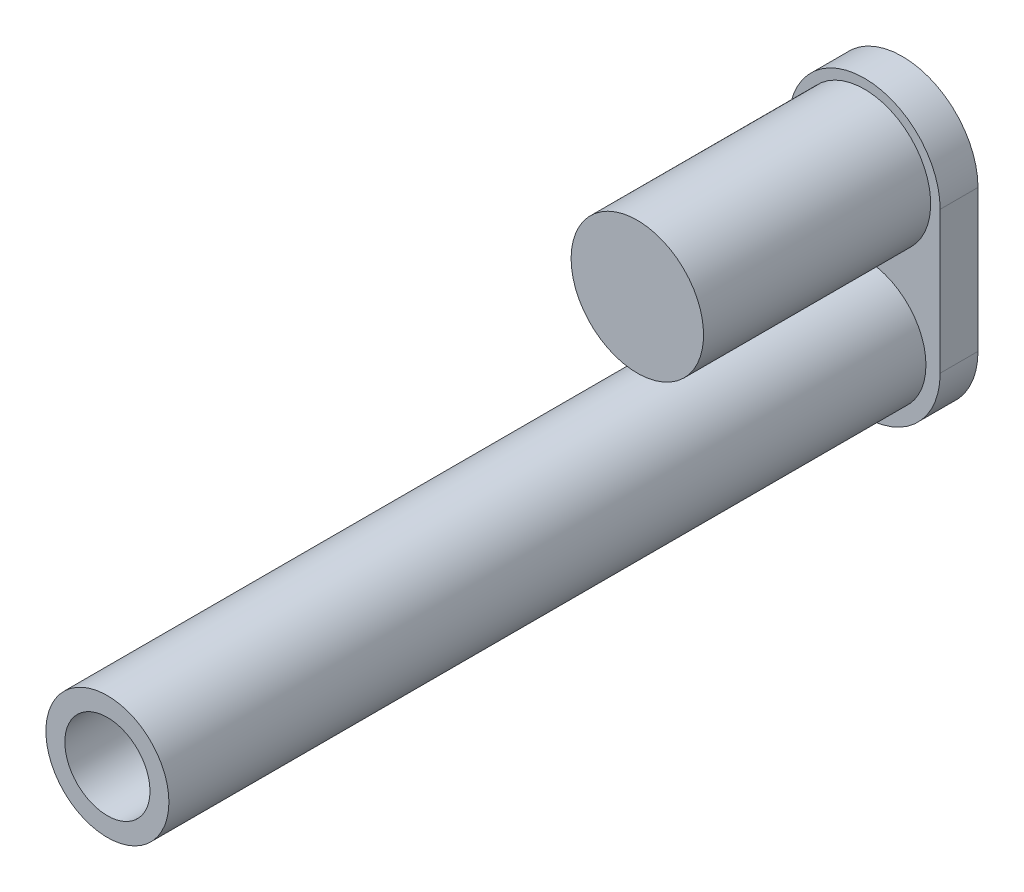
from build123d import *

# Parameters (mm, degrees)
BOSS_EXTRUDE1_DEPTH      = 12.7
SKETCH2_R                = 22.225
BOSS_EXTRUDE2_DEPTH      = 76.2
SKETCH3_R                = 20.6375
BOSS_EXTRUDE3_DEPTH      = 254
SKETCH4_R                = 14.2875
CUT_EXTRUDE1_DEPTH       = 203.2
BOSS_EXTRUDE4_DEPTH      = 6.35
BOSS_EXTRUDE4_DEPTH_BACK = 6.35
SKETCH5_W                = 12.7
SKETCH5_H                = 12.7
SKETCH5_R                = 3.175


with BuildPart() as part:
    # Sketch1 → Boss-Extrude1 (new body)
    with BuildSketch(Plane.XY):
        with BuildLine():
            Line((-25.4, 0), (-25.4, 47.625))
            ThreePointArc((-25.4, 47.625), (0, 73.025), (25.4, 47.625))
            Line((25.4, 47.625), (25.4, 0))
            ThreePointArc((25.4, 0), (0, -25.4), (-25.4, 0))
        make_face()
    extrude(amount=BOSS_EXTRUDE1_DEPTH)

    # Sketch2 → Boss-Extrude2 (add)
    with BuildSketch(Plane.XY.offset(12.7)):
        with Locations(Location((0, 47.625, 0), (0, 0, 180))):
            Circle(SKETCH2_R)
    extrude(amount=BOSS_EXTRUDE2_DEPTH)

    # Sketch3 → Boss-Extrude3 (add)
    with BuildSketch(Plane.XY.offset(12.7)):
        Circle(SKETCH3_R)
    extrude(amount=BOSS_EXTRUDE3_DEPTH)

    # Sketch4 → Cut-Extrude1 (cut)
    with BuildSketch(Plane.XY.offset(266.7)):
        Circle(SKETCH4_R)
    extrude(amount=-CUT_EXTRUDE1_DEPTH, mode=Mode.SUBTRACT)

    # Sketch5 → Boss-Extrude4 (add, two sides: drawn at the far end of the back side and taken through both)
    with BuildSketch(Plane(origin=(0, 0, 0), x_dir=(0, 0, -1), z_dir=(1, 0, 0)).offset(-BOSS_EXTRUDE4_DEPTH_BACK)):
        with Locations((6.35, 0)):
            Rectangle(SKETCH5_W, SKETCH5_H)
        with Locations((7.9375, 0)):
            Circle(SKETCH5_R, mode=Mode.SUBTRACT)
    extrude(amount=BOSS_EXTRUDE4_DEPTH + BOSS_EXTRUDE4_DEPTH_BACK)


solid = part.part
